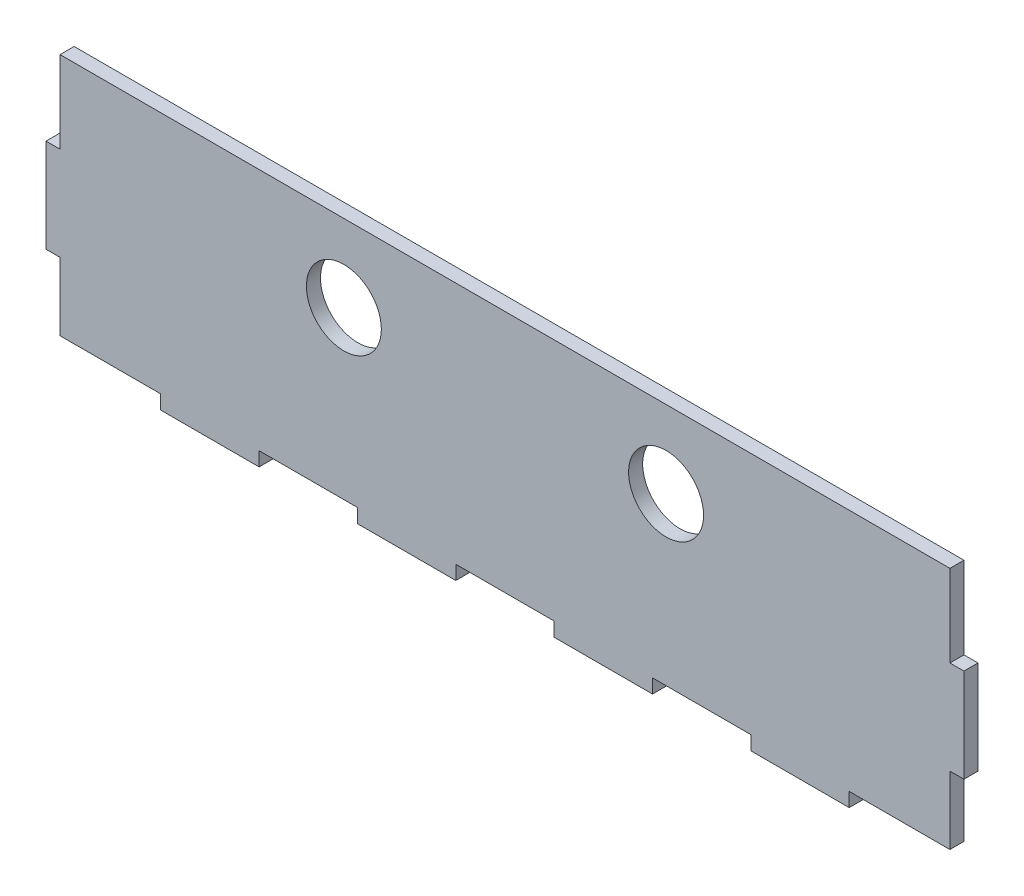
from build123d import *

# Parameters (mm, degrees)
SKETCH1_R           = 8
BOSS_EXTRUDE1_DEPTH = 3


with BuildPart() as part:
    # Sketch1 → Boss-Extrude1 (new body)
    with BuildSketch(Plane.XY):
        Polygon((-10.5, -24.5), (0, -24.5), (10.5, -24.5), (10.5, -27.5), (31.5, -27.5), (31.5, -24.5), (52.5, -24.5), (52.5, -27.5), (73.5, -27.5), (73.5, -24.5), (95, -24.5), (95, -10), (98, -10), (98, 10), (95, 10), (95, 27.5), (-95, 27.5), (-95, 10), (-98, 10), (-98, -10), (-95, -10), (-95, -24.5), (-73.5, -24.5), (-73.5, -27.5), (-52.5, -27.5), (-52.5, -24.5), (-31.5, -24.5), (-31.5, -27.5), (-10.5, -27.5), align=None)
        with Locations((-34.4, 11)):
            Circle(SKETCH1_R, mode=Mode.SUBTRACT)
        with Locations((34.4, 11)):
            Circle(SKETCH1_R, mode=Mode.SUBTRACT)
    extrude(amount=BOSS_EXTRUDE1_DEPTH)


solid = part.part
